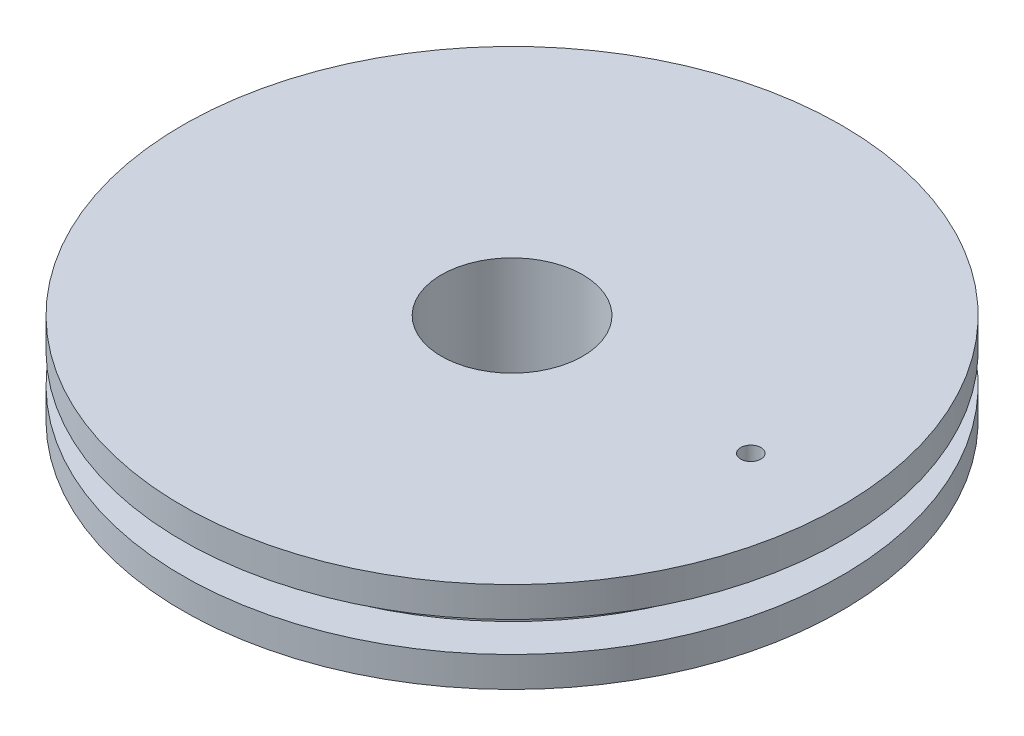
from build123d import *

# Parameters (mm, degrees)
SKETCH2_R          = 1
CUT_EXTRUDE1_DEPTH = 52.147287318


with BuildPart() as part:
    # Sketch1 → Revolve1 (revolve)
    with BuildSketch(Plane.XY, mode=Mode.PRIVATE) as revolve1_sk:
        Polygon((32.65, -4.5), (10, -4.5), (10, -17.5), (7, -17.5), (7, 4.5), (32.65, 4.5), (32.65, 1.5), (28.65, 1.5), (28.65, -1.5), (32.65, -1.5), align=None)
    revolve(revolve1_sk.sketch.rotate(Axis((0, 0, 0), (0, 1, 0)), 90), axis=Axis((0, 0, 0), (0, 1, 0)))

    # Sketch2 → Cut-Extrude1 (cut, through all)
    with BuildSketch(Plane(origin=(0, 4.5, 0), x_dir=(1, 0, 0), z_dir=(0, 1, 0))):
        with Locations(Location((23.65, 0, 0), (0, 0, 270))):
            Circle(SKETCH2_R)
    extrude(amount=-CUT_EXTRUDE1_DEPTH, mode=Mode.SUBTRACT)


solid = part.part
